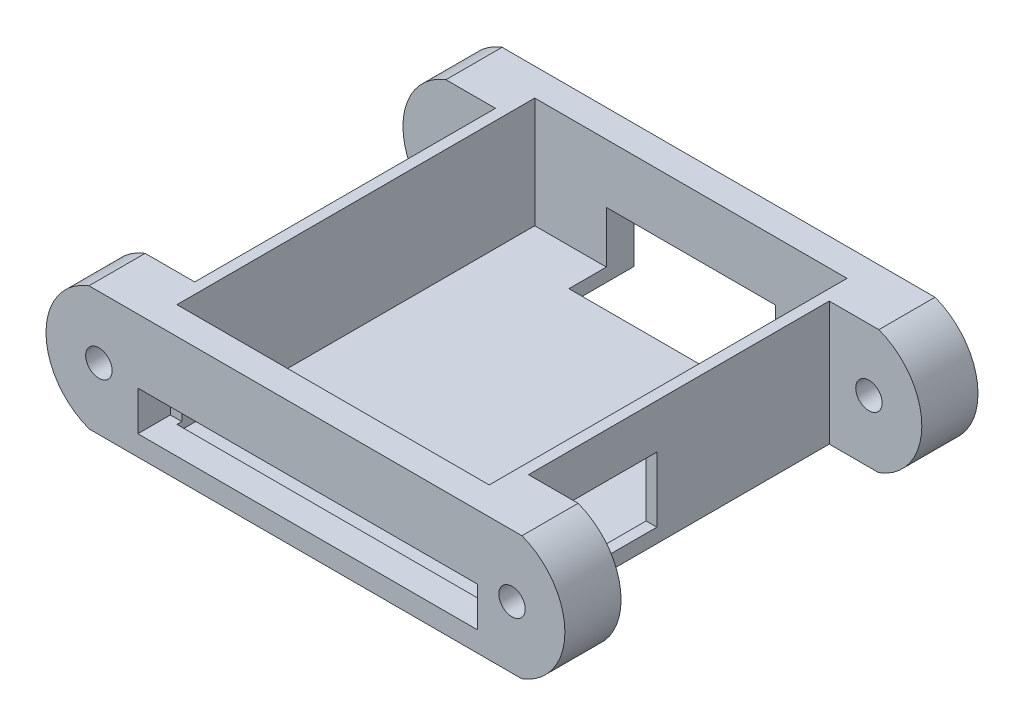
from build123d import *

# Parameters (mm, degrees)
SKETCH1_W           = 86.36
SKETCH1_H           = 63.5
BOSS_EXTRUDE1_DEPTH = 19.05
CUT_EXTRUDE1_DEPTH  = 63.5
SKETCH3_W           = 14.224
SKETCH3_H           = 46.228
CUT_EXTRUDE4_DEPTH  = 63.5
SKETCH4_R           = 2.032
CUT_EXTRUDE5_DEPTH  = 63.5
SKETCH6_W           = 48
SKETCH6_H           = 55
CUT_EXTRUDE6_DEPTH  = 17
SKETCH7_W           = 15
SKETCH7_H           = 10
CUT_EXTRUDE10_DEPTH = 17
SKETCH9_W           = 26
SKETCH9_H           = 20
CUT_EXTRUDE11_DEPTH = 10
SKETCH10_W          = 52.188826159
SKETCH10_H          = 6.083943305
CUT_EXTRUDE12_DEPTH = 5


with BuildPart() as part:
    # Sketch1 → Boss-Extrude1 (new body)
    with BuildSketch(Plane(origin=(0, 0, 0), x_dir=(1, 0, 0), z_dir=(0, 1, 0))):
        Rectangle(SKETCH1_W, SKETCH1_H)
    extrude(amount=BOSS_EXTRUDE1_DEPTH)

    # Sketch2 → Cut-Extrude1 (cut)
    with BuildSketch(Plane.XY.offset(31.75)):
        with BuildLine():
            Line((-43.18, 19.05), (-43.18, 0))
            Line((-43.18, 0), (-33.232925003, 0))
            ThreePointArc((-33.232925003, 0), (-39.877976383, 9.510716436), (-33.274, 19.05))
            Line((-33.274, 19.05), (-43.18, 19.05))
        make_face()
        with BuildLine():
            Line((43.18, 19.05), (43.18, 0))
            Line((43.18, 0), (33.232925003, 0))
            ThreePointArc((33.232925003, 0), (39.877976383, 9.510716436), (33.274, 19.05))
            Line((33.274, 19.05), (43.18, 19.05))
        make_face()
    extrude(amount=-CUT_EXTRUDE1_DEPTH, mode=Mode.SUBTRACT)

    # Sketch3 → Cut-Extrude4 (cut)
    with BuildSketch(Plane(origin=(0, 19.05, 0), x_dir=(1, 0, 0), z_dir=(0, 1, 0))):
        with Locations((-32.766, 0)):
            Rectangle(SKETCH3_W, SKETCH3_H)
        with Locations((32.766, 0)):
            Rectangle(SKETCH3_W, SKETCH3_H)
    extrude(amount=-CUT_EXTRUDE4_DEPTH, mode=Mode.SUBTRACT)

    # Sketch4 → Cut-Extrude5 (cut)
    with BuildSketch(Plane.XY.offset(31.75)):
        with Locations((-31.75, 9.525)):
            Circle(SKETCH4_R)
        with Locations((31.75, 9.525)):
            Circle(SKETCH4_R)
    extrude(amount=-CUT_EXTRUDE5_DEPTH, mode=Mode.SUBTRACT)

    # Sketch6 → Cut-Extrude6 (cut)
    with BuildSketch(Plane(origin=(0, 19.05, 0), x_dir=(1, 0, 0), z_dir=(0, 1, 0))):
        Rectangle(SKETCH6_W, SKETCH6_H)
    extrude(amount=-CUT_EXTRUDE6_DEPTH, mode=Mode.SUBTRACT)

    # Sketch7 → Cut-Extrude10 (cut)
    with BuildSketch(Plane(origin=(25.654, 0, 0), x_dir=(0, 0, -1), z_dir=(1, 0, 0))):
        with Locations((-10.886, 7.2)):
            Rectangle(SKETCH7_W, SKETCH7_H)
    extrude(amount=-CUT_EXTRUDE10_DEPTH, mode=Mode.SUBTRACT)

    # Sketch9 → Cut-Extrude11 (cut)
    with BuildSketch(Plane(origin=(0, 0, -31.75), x_dir=(-1, 0, 0), z_dir=(0, 0, -1))):
        Rectangle(SKETCH9_W, SKETCH9_H)
    extrude(amount=-CUT_EXTRUDE11_DEPTH, mode=Mode.SUBTRACT)

    # Sketch10 → Cut-Extrude12 (cut)
    with BuildSketch(Plane.XY.offset(31.75)):
        with Locations((0.33271565, 6.150312699)):
            Rectangle(SKETCH10_W, SKETCH10_H)
    extrude(amount=-CUT_EXTRUDE12_DEPTH, mode=Mode.SUBTRACT)


solid = part.part
